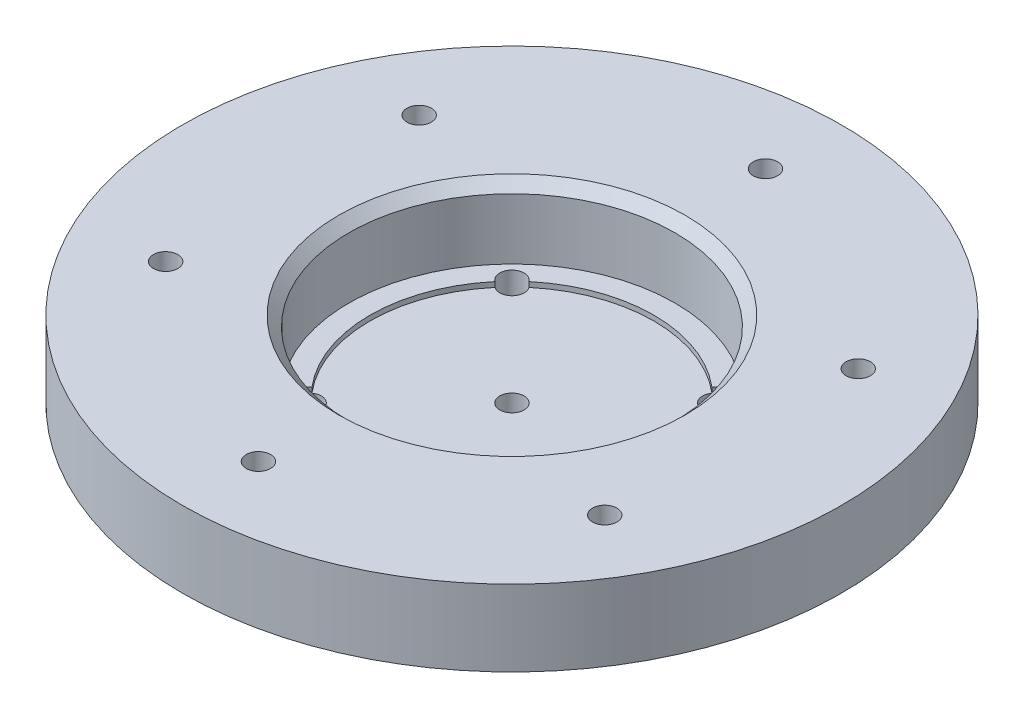
from build123d import *

# Parameters (mm, degrees)
F_2_4_2_4_DURCHMESSER_BOHRUNG1_D = 2.4
KREISMUSTER1_COUNT               = 6
F_2_4_2_4_DURCHMESSER_BOHRUNG2_D = 2.4
FASE1_SIZE                       = 1
FASE2_SIZE                       = 1


with BuildPart() as part:
    # Skizze1 → Rotation1 (revolve)
    with BuildSketch(Plane.XY, mode=Mode.PRIVATE) as rotation1_sk:
        Polygon((0, 0), (20, 0), (20, 7.5), (32.5, 7.5), (32.5, 15), (16.075, 15), (16.075, 8), (14, 8), (14, 7.5), (0, 7.5), align=None)
    revolve(rotation1_sk.sketch.rotate(Axis((0, 0, 0), (0, -1, 0)), 90), axis=Axis((0, 0, 0), (0, -1, 0)))

    # Ø2.4 (2.4) Durchmesser Bohrung1 (through all)
    with Locations(Plane(origin=(0, 15, 0), x_dir=(1, 0, 0), z_dir=(0, 1, 0))):
        with Locations((0, 25)):
            f_2_4_2_4_durchmesser_bohrung1 = Hole(F_2_4_2_4_DURCHMESSER_BOHRUNG1_D / 2)

    # Kreismuster1: Ø2.4 (2.4) Durchmesser Bohrung1 ×6 about axis
    kreismuster1_axis = Axis((0, 0, 0), (0, 1, 0))
    for i in range(1, KREISMUSTER1_COUNT):
        add(f_2_4_2_4_durchmesser_bohrung1.rotate(kreismuster1_axis, i * 360 / KREISMUSTER1_COUNT), mode=Mode.SUBTRACT)

    # Ø2.4 (2.4) Durchmesser Bohrung2 (through all)
    with Locations(Plane(origin=(0, 0, 0), x_dir=(-1, 0, 0), z_dir=(0, -1, 0))):
        with Locations((0, 0), (10, 10), (-10, -10), (-10, 10), (10, -10)):
            Hole(F_2_4_2_4_DURCHMESSER_BOHRUNG2_D / 2)

    # Fase1
    fase1_edges = [part.edges().sort_by_distance(p)[0] for p in [
        (0, 15, -16.075),
    ]]
    chamfer(fase1_edges, length=FASE1_SIZE)

    # Fase2
    fase2_edges = [part.edges().sort_by_distance(p)[0] for p in [
        (0, 0, -20),
    ]]
    chamfer(fase2_edges, length=FASE2_SIZE)


solid = part.part
